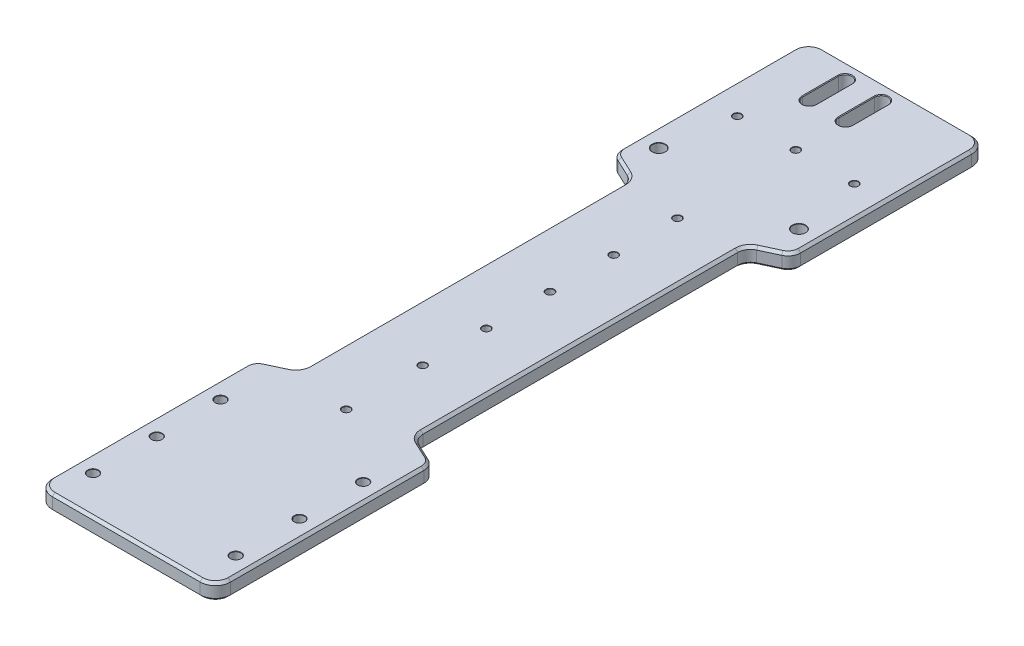
from build123d import *

# Parameters (mm, degrees)
BOSS_EXTRUDE1_DEPTH            = 6.35
SKETCH3_W                      = 70
SKETCH3_H                      = 6.35
BOSS_EXTRUDE2_DEPTH            = 58.8
F_4_0MM_DOWEL_HOLE1_AT_2_COUNT = 2
F_4_0MM_DOWEL_HOLE1_AT_2_PITCH = 25
F_4_0MM_DOWEL_HOLE1_AT_3_COUNT = 2
F_4_0MM_DOWEL_HOLE1_AT_3_PITCH = 50
F_4_0MM_DOWEL_HOLE1_AT_4_COUNT = 2
F_4_0MM_DOWEL_HOLE1_AT_4_PITCH = 75.073297516
F_4_0MM_DOWEL_HOLE1_AT_5_COUNT = 2
F_4_0MM_DOWEL_HOLE1_AT_5_PITCH = 61.326992426
F_4_0MM_DOWEL_HOLE1_AT_6_COUNT = 2
F_4_0MM_DOWEL_HOLE1_AT_6_PITCH = 56
F_3_0MM_DOWEL_HOLE1_AT_2_COUNT = 2
F_3_0MM_DOWEL_HOLE1_AT_2_PITCH = 25
F_3_0MM_DOWEL_HOLE1_AT_3_COUNT = 2
F_3_0MM_DOWEL_HOLE1_AT_3_PITCH = 50
F_3_0MM_DOWEL_HOLE1_AT_4_COUNT = 2
F_3_0MM_DOWEL_HOLE1_AT_4_PITCH = 75
F_3_0MM_DOWEL_HOLE1_AT_5_COUNT = 2
F_3_0MM_DOWEL_HOLE1_AT_5_PITCH = 100
F_3_0MM_DOWEL_HOLE1_AT_6_COUNT = 2
F_3_0MM_DOWEL_HOLE1_AT_6_PITCH = 130
F_5_0MM_DOWEL_HOLE1_AT_2_COUNT = 2
F_5_0MM_DOWEL_HOLE1_AT_2_PITCH = 55.000000001
CUT_EXTRUDE3_DEPTH             = 185.266010159
CUT_EXTRUDE4_DEPTH             = 2.5
F_3_0MM_DOWEL_HOLE2_AT_2_COUNT = 2
F_3_0MM_DOWEL_HOLE2_AT_2_PITCH = 22.972002492
F_3_0MM_DOWEL_HOLE2_AT_3_COUNT = 2
F_3_0MM_DOWEL_HOLE2_AT_3_PITCH = 45.944004984
FILLET1_R                      = 6
CHAMFER8_SIZE                  = 1
CHAMFER11_SIZE                 = 0.25


with BuildPart() as part:
    # Sketch1 → Boss-Extrude1 (new body)
    with BuildSketch(Plane(origin=(0, 0, 0), x_dir=(1, 0, 0), z_dir=(0, 1, 0))):
        with BuildLine():
            Line((35, 122), (-35, 122))
            Line((-35, 122), (-35, 107.685351304))
            ThreePointArc((-35, 107.685351304), (-34.216957229, 104.998853262), (-32.113091309, 103.153812369))
            Line((-32.113091309, 103.153812369), (-25.386908691, 100.017341904))
            ThreePointArc((-25.386908691, 100.017341904), (-23.283042771, 98.172301011), (-22.5, 95.485802969))
            Line((-22.5, 95.485802969), (-22.5, -27.985802969))
            ThreePointArc((-22.5, -27.985802969), (-23.283042771, -30.672301011), (-25.386908691, -32.517341904))
            Line((-25.386908691, -32.517341904), (-32.113091309, -35.653812369))
            ThreePointArc((-32.113091309, -35.653812369), (-34.216957229, -37.498853262), (-35, -40.185351304))
            Line((-35, -40.185351304), (-35, -122))
            Line((-35, -122), (35, -122))
            Line((35, -122), (35, -40.185351304))
            ThreePointArc((35, -40.185351304), (34.216957229, -37.498853262), (32.113091309, -35.653812369))
            Line((32.113091309, -35.653812369), (25.386908691, -32.517341904))
            ThreePointArc((25.386908691, -32.517341904), (23.283042771, -30.672301011), (22.5, -27.985802969))
            Line((22.5, -27.985802969), (22.5, 95.485802969))
            ThreePointArc((22.5, 95.485802969), (23.283042771, 98.172301011), (25.386908691, 100.017341904))
            Line((25.386908691, 100.017341904), (32.113091309, 103.153812369))
            ThreePointArc((32.113091309, 103.153812369), (34.216957229, 104.998853262), (35, 107.685351304))
            Line((35, 107.685351304), (35, 122))
        make_face()
    extrude(amount=BOSS_EXTRUDE1_DEPTH)

    # Sketch3 → Boss-Extrude2 (add)
    with BuildSketch(Plane(origin=(0, 0, -122), x_dir=(-1, 0, 0), z_dir=(0, 0, -1))):
        with Locations((0, 3.175)):
            Rectangle(SKETCH3_W, SKETCH3_H)
    extrude(amount=BOSS_EXTRUDE2_DEPTH)

    # Sketch5 → Ø4.0mm Dowel Hole1 (revolve, cut)
    with BuildSketch(Plane(origin=(-28, 0, 57), x_dir=(0, 0, -1), z_dir=(1, 0, 0))):
        Polygon((0, 0), (0, 6.35), (2.125, 6.35), (2, 6.225), (2, 0.125), (2.125, 0), align=None)
    f_4_0mm_dowel_hole1 = revolve(axis=Axis((-28, -6.35, 57), (0, 1, 0)), mode=Mode.SUBTRACT)

    # Ø4.0mm Dowel Hole1 at 2: Ø4.0mm Dowel Hole1 ×2
    with Locations(*[(0, 0, i * F_4_0MM_DOWEL_HOLE1_AT_2_PITCH) for i in range(1, F_4_0MM_DOWEL_HOLE1_AT_2_COUNT)]):
        add(f_4_0mm_dowel_hole1, mode=Mode.SUBTRACT)

    # Ø4.0mm Dowel Hole1 at 3: Ø4.0mm Dowel Hole1 ×2
    with Locations(*[(0, 0, i * F_4_0MM_DOWEL_HOLE1_AT_3_PITCH) for i in range(1, F_4_0MM_DOWEL_HOLE1_AT_3_COUNT)]):
        add(f_4_0mm_dowel_hole1, mode=Mode.SUBTRACT)

    # Ø4.0mm Dowel Hole1 at 4: Ø4.0mm Dowel Hole1 ×2
    with Locations(*[Vector(0.7459376616259149, 0, 0.6660157693088521) * (i * F_4_0MM_DOWEL_HOLE1_AT_4_PITCH) for i in range(1, F_4_0MM_DOWEL_HOLE1_AT_4_COUNT)]):
        add(f_4_0mm_dowel_hole1, mode=Mode.SUBTRACT)

    # Ø4.0mm Dowel Hole1 at 5: Ø4.0mm Dowel Hole1 ×2
    with Locations(*[Vector(0.9131378824375115, 0, 0.40765084037388855) * (i * F_4_0MM_DOWEL_HOLE1_AT_5_PITCH) for i in range(1, F_4_0MM_DOWEL_HOLE1_AT_5_COUNT)]):
        add(f_4_0mm_dowel_hole1, mode=Mode.SUBTRACT)

    # Ø4.0mm Dowel Hole1 at 6: Ø4.0mm Dowel Hole1 ×2
    with Locations(*[(i * F_4_0MM_DOWEL_HOLE1_AT_6_PITCH, 0, 0) for i in range(1, F_4_0MM_DOWEL_HOLE1_AT_6_COUNT)]):
        add(f_4_0mm_dowel_hole1, mode=Mode.SUBTRACT)

    # Sketch7 → Ø3.0mm Dowel Hole1 (revolve, cut)
    with BuildSketch(Plane(origin=(0, 6.35, -94.321182298), x_dir=(0, 0, 1), z_dir=(1, 0, 0))):
        Polygon((0, 0), (0, 6.35), (1.625, 6.35), (1.5, 6.225), (1.5, 0.125), (1.625, 0), align=None)
    f_3_0mm_dowel_hole1 = revolve(axis=Axis((0, 12.7, -94.321182298), (0, -1, 0)), mode=Mode.SUBTRACT)

    # Ø3.0mm Dowel Hole1 at 2: Ø3.0mm Dowel Hole1 ×2
    with Locations(*[(0, 0, i * F_3_0MM_DOWEL_HOLE1_AT_2_PITCH) for i in range(1, F_3_0MM_DOWEL_HOLE1_AT_2_COUNT)]):
        add(f_3_0mm_dowel_hole1, mode=Mode.SUBTRACT)

    # Ø3.0mm Dowel Hole1 at 3: Ø3.0mm Dowel Hole1 ×2
    with Locations(*[(0, 0, i * F_3_0MM_DOWEL_HOLE1_AT_3_PITCH) for i in range(1, F_3_0MM_DOWEL_HOLE1_AT_3_COUNT)]):
        add(f_3_0mm_dowel_hole1, mode=Mode.SUBTRACT)

    # Ø3.0mm Dowel Hole1 at 4: Ø3.0mm Dowel Hole1 ×2
    with Locations(*[(0, 0, i * F_3_0MM_DOWEL_HOLE1_AT_4_PITCH) for i in range(1, F_3_0MM_DOWEL_HOLE1_AT_4_COUNT)]):
        add(f_3_0mm_dowel_hole1, mode=Mode.SUBTRACT)

    # Ø3.0mm Dowel Hole1 at 5: Ø3.0mm Dowel Hole1 ×2
    with Locations(*[(0, 0, i * F_3_0MM_DOWEL_HOLE1_AT_5_PITCH) for i in range(1, F_3_0MM_DOWEL_HOLE1_AT_5_COUNT)]):
        add(f_3_0mm_dowel_hole1, mode=Mode.SUBTRACT)

    # Ø3.0mm Dowel Hole1 at 6: Ø3.0mm Dowel Hole1 ×2
    with Locations(*[(0, 0, i * F_3_0MM_DOWEL_HOLE1_AT_6_PITCH) for i in range(1, F_3_0MM_DOWEL_HOLE1_AT_6_COUNT)]):
        add(f_3_0mm_dowel_hole1, mode=Mode.SUBTRACT)

    # Sketch9 → Ø5.0mm Dowel Hole1 (revolve, cut)
    with BuildSketch(Plane(origin=(27.5, 6.35, -114.5), x_dir=(0, 0, 1), z_dir=(1, 0, 0))):
        Polygon((0, 0), (0, 6.35), (2.625, 6.35), (2.5, 6.225), (2.5, 0.125), (2.625, 0), align=None)
    f_5_0mm_dowel_hole1 = revolve(axis=Axis((27.5, 12.7, -114.5), (0, -1, 0)), mode=Mode.SUBTRACT)

    # Ø5.0mm Dowel Hole1 at 2: Ø5.0mm Dowel Hole1 ×2
    with Locations(*[(-i * F_5_0MM_DOWEL_HOLE1_AT_2_PITCH, 0, 0) for i in range(1, F_5_0MM_DOWEL_HOLE1_AT_2_COUNT)]):
        add(f_5_0mm_dowel_hole1, mode=Mode.SUBTRACT)

    # Sketch10 → Cut-Extrude3 (cut, through all)
    with BuildSketch(Plane(origin=(0, 6.35, 0), x_dir=(1, 0, 0), z_dir=(0, 1, 0))):
        with BuildLine():
            Line((-11.55, 174.3), (-11.55, 160.3))
            ThreePointArc((-11.55, 160.3), (-14.2, 157.65), (-16.85, 160.3))
            Line((-16.85, 160.3), (-16.85, 174.3))
            ThreePointArc((-16.85, 174.3), (-14.2, 176.95), (-11.55, 174.3))
        make_face()
        with BuildLine():
            Line((2.65, 174.3), (2.65, 160.3))
            ThreePointArc((2.65, 160.3), (0, 157.65), (-2.65, 160.3))
            Line((-2.65, 160.3), (-2.65, 174.3))
            ThreePointArc((-2.65, 174.3), (0, 176.95), (2.65, 174.3))
        make_face()
    extrude(amount=-CUT_EXTRUDE3_DEPTH, mode=Mode.SUBTRACT)

    # Sketch12 → Cut-Extrude4 (cut)
    with BuildSketch(Plane.XZ):
        with BuildLine():
            Line((24, -120.742675652), (-24, -120.742675652))
            ThreePointArc((-24, -120.742675652), (-28.242640687, -122.500034965), (-30, -126.742675652))
            Line((-30, -126.742675652), (-30, -149.742675652))
            ThreePointArc((-30, -149.742675652), (-28.242640687, -153.985316339), (-24, -155.742675652))
            Line((-24, -155.742675652), (24, -155.742675652))
            ThreePointArc((24, -155.742675652), (28.242640687, -153.985316339), (30, -149.742675652))
            Line((30, -149.742675652), (30, -126.742675652))
            ThreePointArc((30, -126.742675652), (28.242640687, -122.500034965), (24, -120.742675652))
        make_face()
    extrude(amount=-CUT_EXTRUDE4_DEPTH, mode=Mode.SUBTRACT)

    # Sketch15 → Ø3.0mm Dowel Hole2 (revolve, cut)
    with BuildSketch(Plane(origin=(-22.944004984, 2.5, -140.742675652), x_dir=(0, 0, -1), z_dir=(1, 0, 0))):
        Polygon((0, 0), (0, 3.85), (1.625, 3.85), (1.5, 3.725), (1.5, 0.125), (1.625, 0), align=None)
    f_3_0mm_dowel_hole2 = revolve(axis=Axis((-22.944004984, -3.85, -140.742675652), (0, 1, 0)), mode=Mode.SUBTRACT)

    # Ø3.0mm Dowel Hole2 at 2: Ø3.0mm Dowel Hole2 ×2
    with Locations(*[(i * F_3_0MM_DOWEL_HOLE2_AT_2_PITCH, 0, 0) for i in range(1, F_3_0MM_DOWEL_HOLE2_AT_2_COUNT)]):
        add(f_3_0mm_dowel_hole2, mode=Mode.SUBTRACT)

    # Ø3.0mm Dowel Hole2 at 3: Ø3.0mm Dowel Hole2 ×2
    with Locations(*[(i * F_3_0MM_DOWEL_HOLE2_AT_3_PITCH, 0, 0) for i in range(1, F_3_0MM_DOWEL_HOLE2_AT_3_COUNT)]):
        add(f_3_0mm_dowel_hole2, mode=Mode.SUBTRACT)

    # Fillet1
    fillet1_edges = [part.edges().sort_by_distance(p)[0] for p in [
        (35, 3.175, 122),
        (-35, 3.175, 122),
        (-35, 3.175, -180.8),
        (35, 3.175, -180.8),
    ]]
    fillet(fillet1_edges, radius=FILLET1_R)

    # Chamfer8
    chamfer8_edges = [part.edges().sort_by_distance(p)[0] for p in [
        (34.216957229, 6.35, 37.498853262),
        (-34.216957229, 0, 37.498853262),
        (-28.75, 0, 34.085577137),
        (-23.283042771, 0, 30.672301011),
        (-22.5, 0, -33.75),
        (28.75, 6.35, 34.085577137),
        (-23.283042771, 0, -98.172301011),
        (-28.75, 0, -101.585577137),
        (-34.216957229, 0, -104.998853262),
        (35, 0, -141.242675652),
        (34.216957229, 0, -104.998853262),
        (28.75, 0, -101.585577137),
        (23.283042771, 0, -98.172301011),
        (22.5, 0, -33.75),
        (23.283042771, 6.35, 30.672301011),
        (23.283042771, 0, 30.672301011),
        (28.75, 0, 34.085577137),
        (34.216957229, 0, 37.498853262),
        (-35, 0, 78.092675652),
        (0, 0, 122),
        (0, 6.35, 122),
        (-35, 0, -141.242675652),
        (0, 0, -180.8),
        (35, 0, 78.092675652),
        (-33.242640687, 0, -179.042640687),
        (33.242640687, 0, -179.042640687),
        (33.242640687, 0, 120.242640687),
        (-33.242640687, 0, 120.242640687),
        (35, 6.35, 78.092675652),
        (0, 6.35, -180.8),
        (-35, 6.35, -141.242675652),
        (-33.242640687, 6.35, -179.042640687),
        (33.242640687, 6.35, -179.042640687),
        (33.242640687, 6.35, 120.242640687),
        (-33.242640687, 6.35, 120.242640687),
        (22.5, 6.35, -33.75),
        (23.283042771, 6.35, -98.172301011),
        (28.75, 6.35, -101.585577137),
        (34.216957229, 6.35, -104.998853262),
        (35, 6.35, -141.242675652),
        (-35, 6.35, 78.092675652),
        (-34.216957229, 6.35, -104.998853262),
        (-28.75, 6.35, -101.585577137),
        (-23.283042771, 6.35, -98.172301011),
        (-22.5, 6.35, -33.75),
        (-23.283042771, 6.35, 30.672301011),
        (-28.75, 6.35, 34.085577137),
        (-34.216957229, 6.35, 37.498853262),
    ]]
    chamfer(chamfer8_edges, length=CHAMFER8_SIZE)

    # Chamfer11
    chamfer11_edges = [part.edges().sort_by_distance(p)[0] for p in [
        (-14.2, 0, -176.95),
        (-11.55, 0, -167.3),
        (-14.2, 0, -157.65),
        (-16.85, 0, -167.3),
        (-14.2, 6.35, -176.95),
        (-16.85, 6.35, -167.3),
        (-14.2, 6.35, -157.65),
        (-11.55, 6.35, -167.3),
        (0, 0, -176.95),
        (2.65, 0, -167.3),
        (0, 0, -157.65),
        (-2.65, 0, -167.3),
        (0, 6.35, -176.95),
        (-2.65, 6.35, -167.3),
        (0, 6.35, -157.65),
        (2.65, 6.35, -167.3),
        (-28.242640687, 0, -122.500034965),
        (-30, 0, -138.242675652),
        (-28.242640687, 0, -153.985316339),
        (0, 0, -155.742675652),
        (28.242640687, 0, -153.985316339),
        (30, 0, -138.242675652),
        (28.242640687, 0, -122.500034965),
        (0, 0, -120.742675652),
    ]]
    chamfer(chamfer11_edges, length=CHAMFER11_SIZE)


solid = part.part
